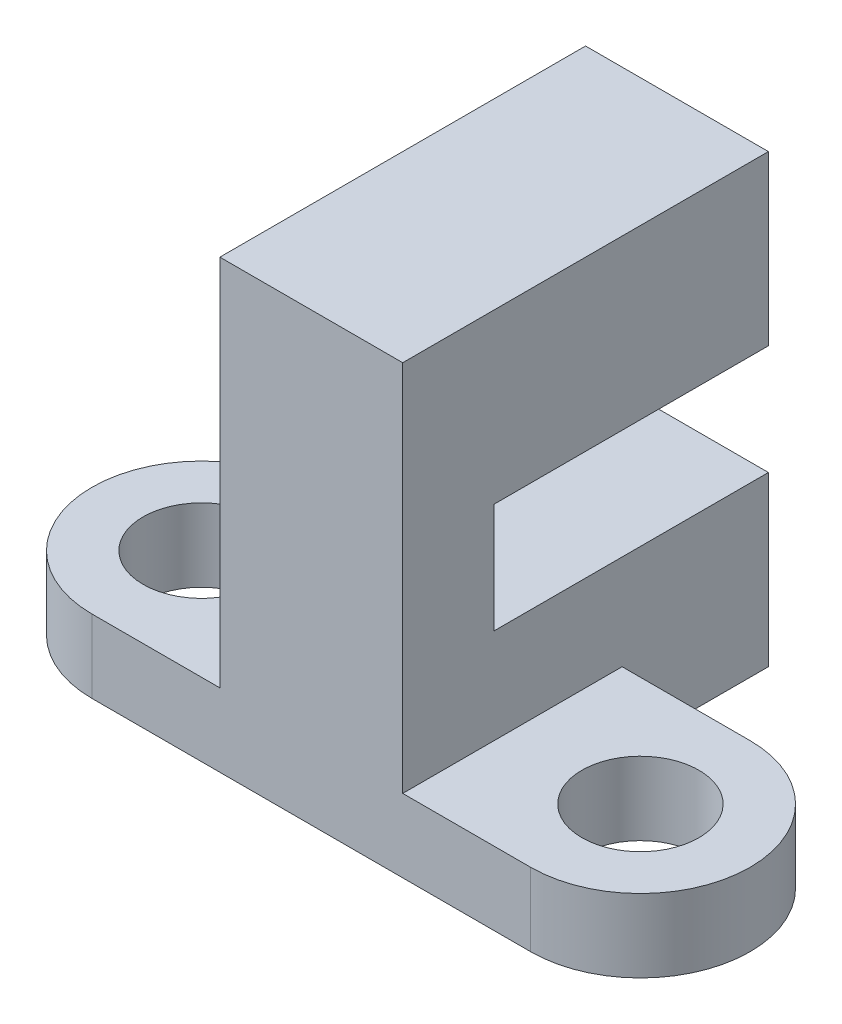
from build123d import *

# Parameters (mm, degrees)
SKETCH_1_R            = 1.6
EXTRUDE_330_DEPTH     = 2
SKETCH_2_W            = 5
SKETCH_2_H            = 10
EXTRUDE_541_DEPTH     = 12.2
SKETCH_3_W            = 5
SKETCH_3_H            = 3
CUT_EXTRUDE_754_DEPTH = 7.5


with BuildPart() as part:
    # Эскиз1 → Extrude 330 (new body)
    with BuildSketch(Plane(origin=(0, 0, 0), x_dir=(1, 0, 0), z_dir=(0, 1, 0))):
        with BuildLine():
            Line((-6, 3), (6, 3))
            ThreePointArc((6, 3), (9, 0), (6, -3))
            Line((6, -3), (-6, -3))
            ThreePointArc((-6, -3), (-9, 0), (-6, 3))
        make_face()
        with Locations(Location((-6, 0, 0), (0, 0, 270))):
            Circle(SKETCH_1_R, mode=Mode.SUBTRACT)
        with Locations(Location((6, 0, 0), (0, 0, 270))):
            Circle(SKETCH_1_R, mode=Mode.SUBTRACT)
    extrude(amount=EXTRUDE_330_DEPTH)

    # Эскиз2 → Extrude 541 (add)
    with BuildSketch(Plane.XZ):
        with Locations((0, -2)):
            Rectangle(SKETCH_2_W, SKETCH_2_H)
    extrude(amount=-EXTRUDE_541_DEPTH)

    # Эскиз3 → Cut-Extrude 754 (cut)
    with BuildSketch(Plane(origin=(0, 0, -7), x_dir=(-1, 0, 0), z_dir=(0, 0, -1))):
        with Locations((0, 6.1)):
            Rectangle(SKETCH_3_W, SKETCH_3_H)
    extrude(amount=-CUT_EXTRUDE_754_DEPTH, mode=Mode.SUBTRACT)


solid = part.part
